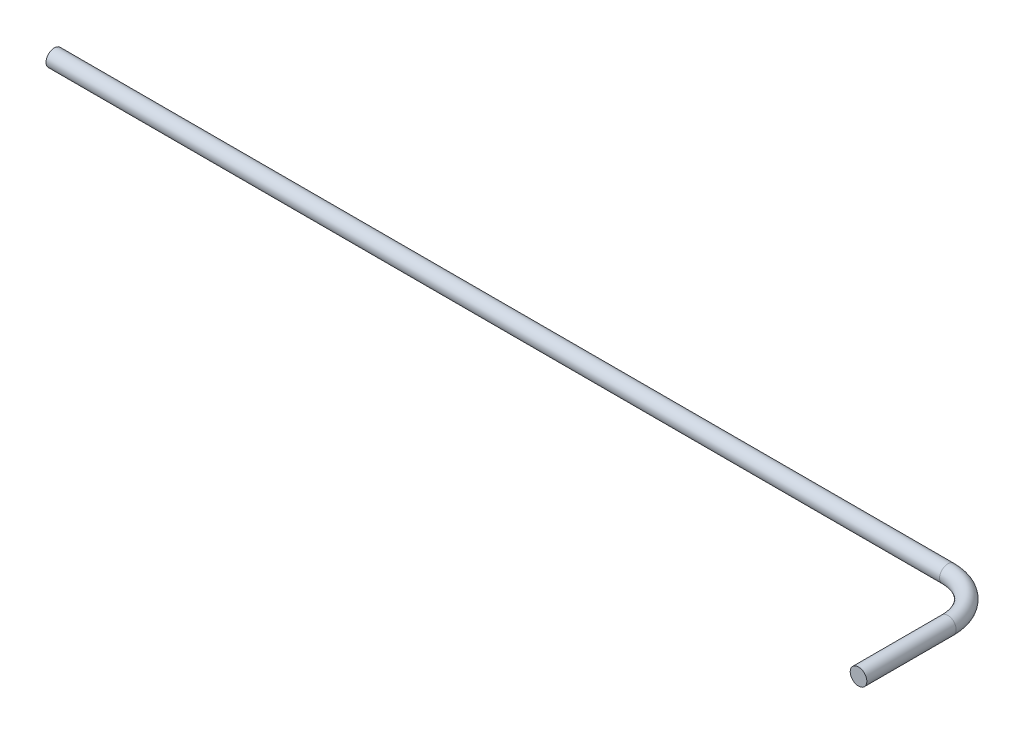
from build123d import *

# Parameters (mm, degrees)
SKETCH1_R           = 1.1811
RODEND_DEPTH        = 12.7
SKETCH4_R           = 1.1811
REVOLVE1_ANGLE      = 90
SKETCH5_R           = 1.1811
BOSS_EXTRUDE1_DEPTH = 127


with BuildPart() as part:
    # Sketch1 → RodEnd (new body)
    with BuildSketch(Plane.XY):
        Circle(SKETCH1_R)
    extrude(amount=-RODEND_DEPTH)

    # Sketch4 → Revolve1 (revolve)
    with BuildSketch(Plane(origin=(0, 0, -12.7), x_dir=(-1, 0, 0), z_dir=(0, 0, -1))):
        with Locations(Location((0, 0, 0), (0, 0, 180))):
            Circle(SKETCH4_R)
    revolve(axis=Axis((-6.35, 0, -12.7), (0, 1, 0)), revolution_arc=REVOLVE1_ANGLE)

    # Sketch5 → Boss-Extrude1 (add)
    with BuildSketch(Plane.ZY.offset(6.35)):
        with Locations(Location((-19.05, 0, 0), (0, 0, 180))):
            Circle(SKETCH5_R)
    extrude(amount=BOSS_EXTRUDE1_DEPTH)


solid = part.part
